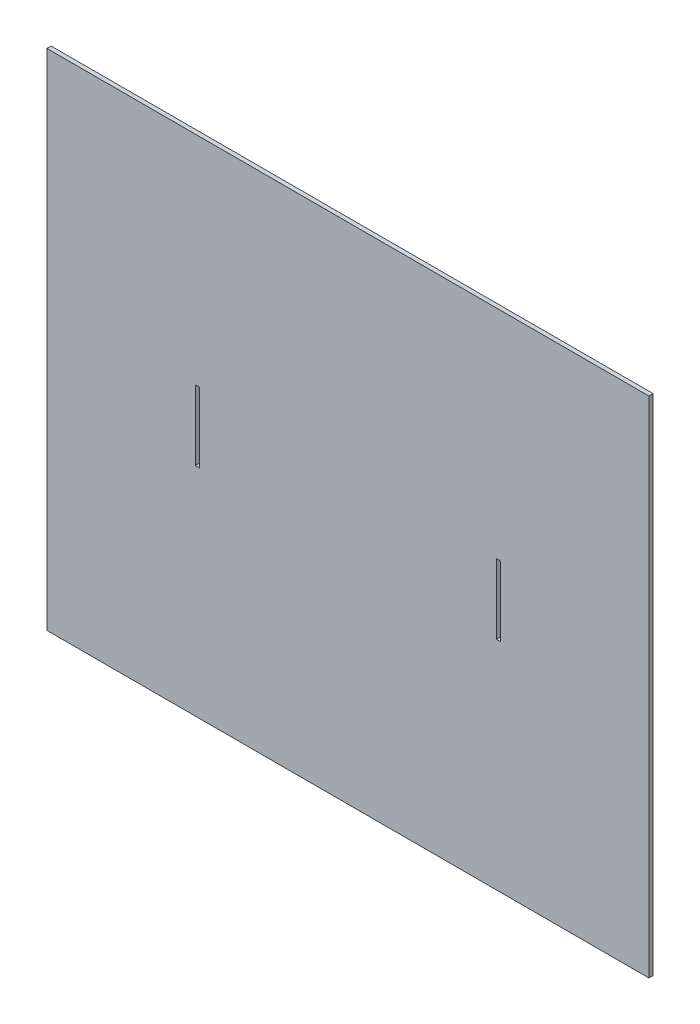
from build123d import *

# Parameters (mm, degrees)
ESQUISSE1_W        = 430
ESQUISSE1_H        = 360
ESQUISSE1_W_2      = 3
ESQUISSE1_H_2      = 50
BOSS_EXTRU_1_DEPTH = 3


with BuildPart() as part:
    # Esquisse1 → Boss.-Extru.1 (new body)
    with BuildSketch(Plane.XY):
        with Locations((215, 180)):
            Rectangle(ESQUISSE1_W, ESQUISSE1_H)
        with Locations((322.5, 180)):
            Rectangle(ESQUISSE1_W_2, ESQUISSE1_H_2, mode=Mode.SUBTRACT)
        with Locations((107.5, 180)):
            Rectangle(ESQUISSE1_W_2, ESQUISSE1_H_2, mode=Mode.SUBTRACT)
    extrude(amount=BOSS_EXTRU_1_DEPTH)


solid = part.part
